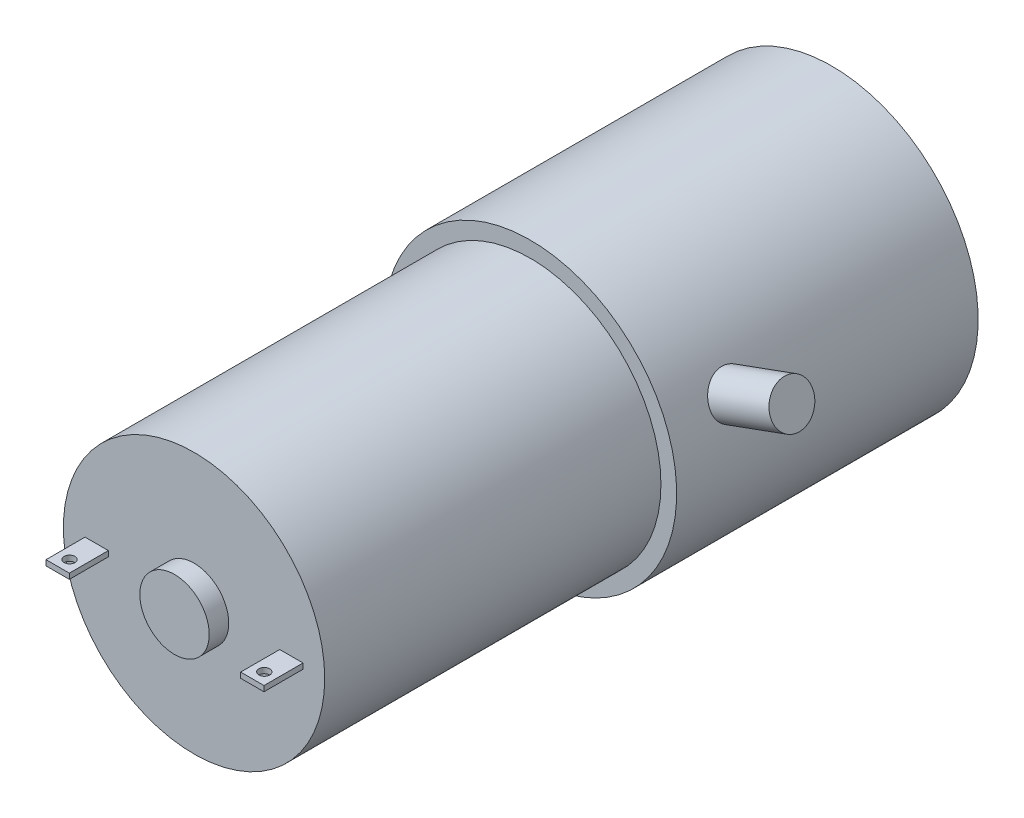
from build123d import *

# Parameters (mm, degrees)
ESQUISSE1_R             = 12.05
BOSS_EXTRU_1_DEPTH      = 31
ESQUISSE3_R             = 13.5
BOSS_EXTRU_2_DEPTH      = 27.8
ESQUISSE8_R             = 3.2
BOSS_EXTRU_6_DEPTH      = 1.8
ESQUISSE4_R             = 2.2
BOSS_EXTRU_3_DEPTH      = 6
BOSS_EXTRU_4_REACH      = 54.437
BOSS_EXTRU_4_END_RADIUS = 13.5
BOSS_EXTRU_4_START      = 6
ESQUISSE5_R             = 2
ESQUISSE7_W             = 2.15
ESQUISSE7_H             = 3.6
ESQUISSE7_R             = 0.5
BOSS_EXTRU_5_DEPTH      = 0.25


with BuildPart() as part:
    # Esquisse1 → Boss.-Extru.1 (new body)
    with BuildSketch(Plane.XY):
        Circle(ESQUISSE1_R)
    extrude(amount=BOSS_EXTRU_1_DEPTH)

    # Esquisse3 → Boss.-Extru.2 (add)
    with BuildSketch(Plane(origin=(0, 0, 0), x_dir=(-1, 0, 0), z_dir=(0, 0, -1))):
        Circle(ESQUISSE3_R)
    extrude(amount=BOSS_EXTRU_2_DEPTH)

    # Esquisse8 → Boss.-Extru.6 (add)
    with BuildSketch(Plane.XY.offset(31)):
        Circle(ESQUISSE8_R)
    extrude(amount=BOSS_EXTRU_6_DEPTH)

    # Esquisse4 → Boss.-Extru.3 (add)
    with BuildSketch(Plane(origin=(0, 0, -27.8), x_dir=(-1, 0, 0), z_dir=(0, 0, -1))):
        Circle(ESQUISSE4_R)
    extrude(amount=BOSS_EXTRU_3_DEPTH)

    # Esquisse7 → Boss.-Extru.5 (add, symmetric)
    # profile 1 of 2: a face of its own
    with BuildSketch(Plane(origin=(0, 0, 0), x_dir=(1, 0, 0), z_dir=(0, 1, 0))):
        with Locations((-8.975, -32.8)):
            Rectangle(ESQUISSE7_W, ESQUISSE7_H)
        with Locations(Location((-8.975, -33.5, 0), (0, 0, 270))):
            Circle(ESQUISSE7_R, mode=Mode.SUBTRACT)
    # profile 2 of 2: a face of its own
    with BuildSketch(Plane(origin=(0, 0, 0), x_dir=(1, 0, 0), z_dir=(0, 1, 0))):
        with Locations((8.975, -32.8)):
            Rectangle(ESQUISSE7_W, ESQUISSE7_H)
        with Locations(Location((8.975, -33.5, 0), (0, 0, 90))):
            Circle(ESQUISSE7_R, mode=Mode.SUBTRACT)
    extrude(amount=BOSS_EXTRU_5_DEPTH, both=True)


with BuildPart() as body_2:
    # Boss.-Extru.4: up to this cylinder (the profile starts outside it)
    boss_extru_4_end = Plane(origin=(0, 0, -5.8), z_dir=(0, 0, 1)) * Cylinder(BOSS_EXTRU_4_END_RADIUS, 136.874, mode=Mode.PRIVATE)
    # Esquisse5 → Boss.-Extru.4 (new, up to the surface)
    with BuildSketch(Plane(origin=(12.685850381, 4.617271935, 0), x_dir=(0, 0, 1), z_dir=(0.9396926207859081, 0.34202014332566943, 0)).offset(BOSS_EXTRU_4_START), mode=Mode.PRIVATE) as boss_extru_4_sk1:
        with Locations(Location((-5.8, 0, 0), (0, 0, 270))):
            Circle(ESQUISSE5_R)
    boss_extru_4_tool1 = extrude(boss_extru_4_sk1.sketch, amount=-BOSS_EXTRU_4_REACH, mode=Mode.PRIVATE) - boss_extru_4_end
    add(boss_extru_4_tool1.solids().sort_by_distance((18.324006, 6.669393, -5.8))[0])


solid = Compound([part.part, body_2.part])
